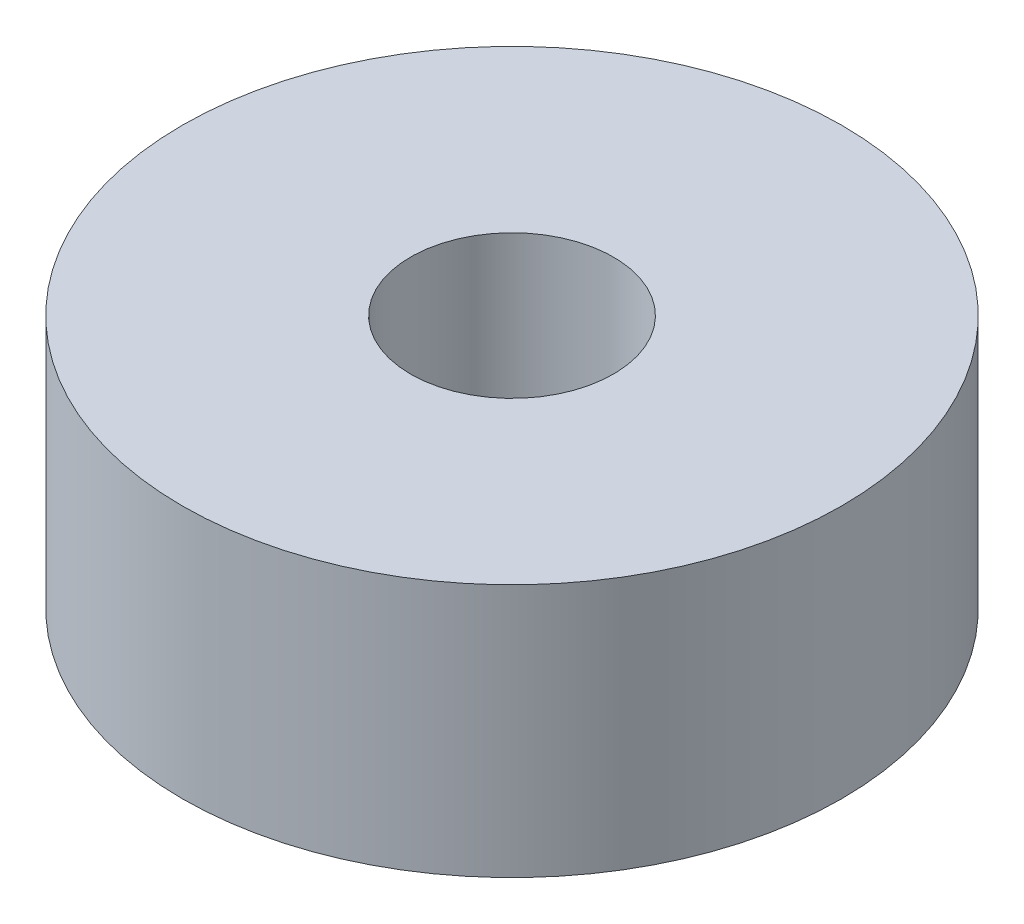
from build123d import *

# Parameters (mm, degrees)
SKETCH1_R           = 6.5
SKETCH1_R_2         = 2
BOSS_EXTRUDE1_DEPTH = 5


with BuildPart() as part:
    # Sketch1 → Boss-Extrude1 (new body)
    with BuildSketch(Plane(origin=(0, 0, 0), x_dir=(1, 0, 0), z_dir=(0, 1, 0))):
        with Locations(Location((0, 0, 0), (0, 0, 270))):
            Circle(SKETCH1_R)
        with Locations(Location((0, 0, 0), (0, 0, 270))):
            Circle(SKETCH1_R_2, mode=Mode.SUBTRACT)
    extrude(amount=BOSS_EXTRUDE1_DEPTH)


solid = part.part
